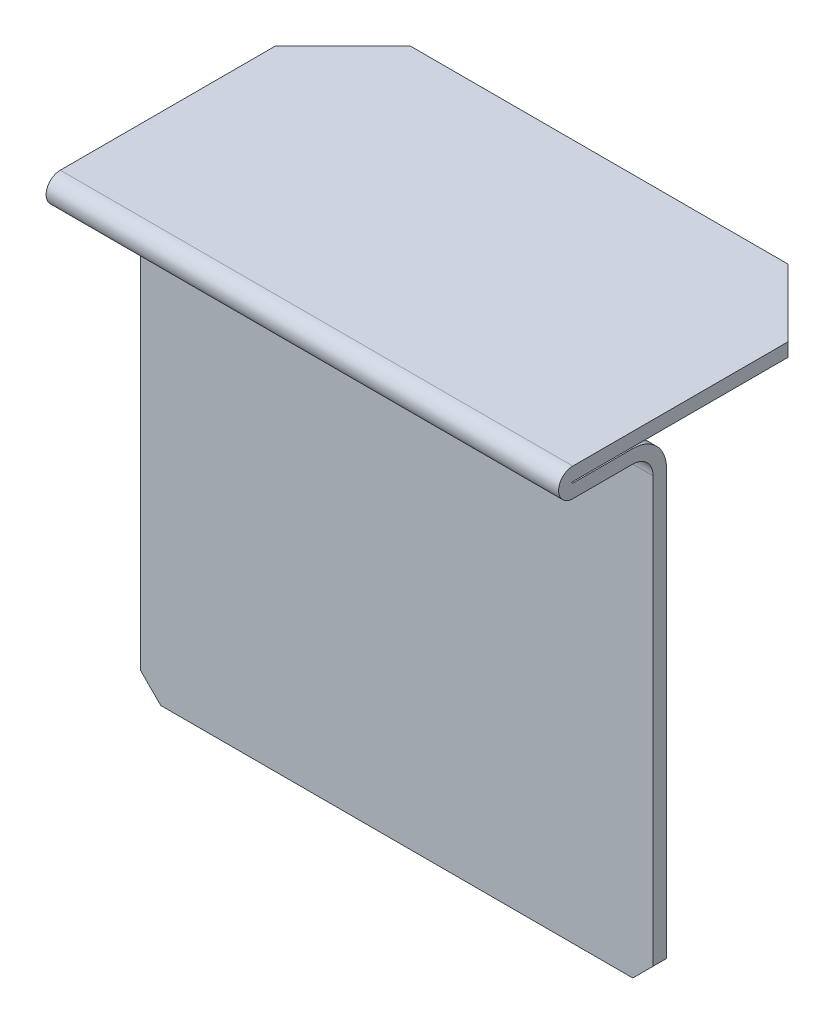
from build123d import *

# Parameters (mm, degrees)
BOSS_EXTRUDE1_DEPTH = 38
CHAMFER1_SIZE       = 5
CHAMFER2_SIZE       = 1.5


with BuildPart() as part:
    # Sketch1 → Boss-Extrude1 (new body)
    with BuildSketch(Plane(origin=(0, 0, 0), x_dir=(0, 0, -1), z_dir=(1, 0, 0))):
        with BuildLine():
            Line((0, 0), (0, 33))
            ThreePointArc((0, 33), (-0.439339828, 34.060660172), (-1.5, 34.5))
            Line((-1.5, 34.5), (-5.95, 34.5))
            ThreePointArc((-5.95, 34.5), (-7, 35.55), (-5.95, 36.6))
            Line((-5.95, 36.6), (15, 36.6))
            Line((15, 36.6), (15, 35.6))
            Line((15, 35.6), (-5.95, 35.6))
            ThreePointArc((-5.95, 35.6), (-6, 35.55), (-5.95, 35.5))
            Line((-5.95, 35.5), (-1.5, 35.5))
            ThreePointArc((-1.5, 35.5), (0.267766953, 34.767766953), (1, 33))
            Line((1, 33), (1, 0))
            Line((1, 0), (0, 0))
        make_face()
    extrude(amount=BOSS_EXTRUDE1_DEPTH)

    # Chamfer1
    chamfer1_edges = [part.edges().sort_by_distance(p)[0] for p in [
        (0, 36.1, -15),
        (38, 36.1, -15),
    ]]
    chamfer(chamfer1_edges, length=CHAMFER1_SIZE)

    # Chamfer2
    chamfer2_edges = [part.edges().sort_by_distance(p)[0] for p in [
        (0, 0, -0.5),
        (38, 0, -0.5),
    ]]
    chamfer(chamfer2_edges, length=CHAMFER2_SIZE)


solid = part.part
